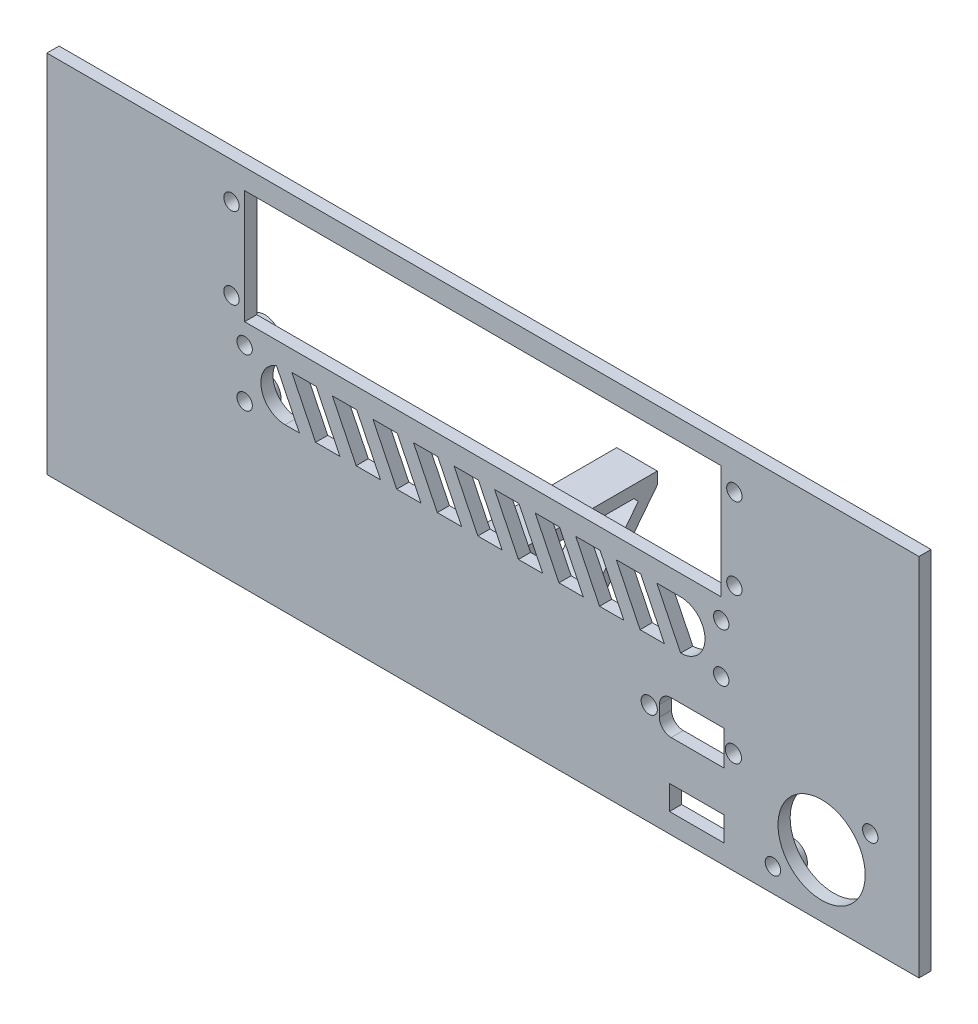
from build123d import *
from OCP.BRepFilletAPI import BRepFilletAPI_MakeChamfer

# Parameters (mm, degrees)
SZKIC1_W                    = 215
SZKIC1_H                    = 90
DODANIE_WYCI_GNI_CIE1_DEPTH = 3
DODANIE_WYCI_GNI_CIE3_DEPTH = 5
SZKIC4_R                    = 1.9
WYTNIJ_WYCI_GNI_CIE1_DEPTH  = 10
SZKIC5_R                    = 1.9
SZKIC5_W                    = 117.5
SZKIC5_H                    = 28
WYTNIJ_WYCI_GNI_CIE2_DEPTH  = 35
SFAZOWANIE1_SIZE            = 2
SFAZOWANIE1_SIZE2           = 1.42483793
SFAZOWANIE1_SIZE2_2         = 2.349845037
SZKIC6_R                    = 10.75
SZKIC6_R_2                  = 1.9
SZKIC6_R_3                  = 2
SZKIC6_W                    = 13.5
SZKIC6_H                    = 6
WYTNIJ_WYCI_GNI_CIE3_DEPTH  = 237.154610372
SZKIC8_R                    = 3.5
SZKIC8_R_2                  = 2
DODANIE_WYCI_GNI_CIE4_DEPTH = 2
SZKIC9_R                    = 1.9
WYTNIJ_WYCI_GNI_CIE4_DEPTH  = 3
DODANIE_WYCI_GNI_CIE5_START = 2
SZKIC10_R                   = 4
SZKIC10_R_2                 = 1.9
DODANIE_WYCI_GNI_CIE5_DEPTH = 2


with BuildPart() as part:
    # Szkic1 → Dodanie-wyciągnięcie1 (new body)
    with BuildSketch(Plane.XY):
        with Locations((107.5, 45)):
            Rectangle(SZKIC1_W, SZKIC1_H)
    extrude(amount=DODANIE_WYCI_GNI_CIE1_DEPTH)

    # Szkic3 → Dodanie-wyciągnięcie3 (add, symmetric)
    with BuildSketch(Plane(origin=(107.5, 0, 0), x_dir=(0, 0, -1), z_dir=(1, 0, 0))):
        Polygon((0, 3), (10, 3), (35, 35), (35, 38), (0, 38), align=None)
        Polygon((3, 11.541451884), (3, 35), (31.193011155, 35), (9.799205499, 7.615928759), align=None, mode=Mode.SUBTRACT)
    extrude(amount=DODANIE_WYCI_GNI_CIE3_DEPTH, both=True)

    # Szkic4 → Wytnij-wyciągnięcie1 (cut)
    with BuildSketch(Plane.XZ.offset(-3)):
        with Locations(Location((107.5, -5, 0), (0, 0, 270))):
            Circle(SZKIC4_R)
    extrude(amount=-WYTNIJ_WYCI_GNI_CIE1_DEPTH, mode=Mode.SUBTRACT)

    # Szkic5 → Wytnij-wyciągnięcie2 (cut)
    with BuildSketch(Plane.XY.offset(3)):
        with Locations((45.5, 81)):
            Circle(SZKIC5_R)
        with Locations((45.5, 61)):
            Circle(SZKIC5_R)
        with Locations((169.5, 61)):
            Circle(SZKIC5_R)
        with Locations((169.5, 81)):
            Circle(SZKIC5_R)
        with Locations((107.5, 71)):
            Rectangle(SZKIC5_W, SZKIC5_H)
    extrude(amount=-WYTNIJ_WYCI_GNI_CIE2_DEPTH, mode=Mode.SUBTRACT)

    # Sfazowanie1: one chamfer whose edges measure the first distance from different faces: ONE call of the kernel's chamfer builder (chamfer() names one face for all edges)
    sfazowanie1_edges_1 = [part.edges().sort_by_distance(p)[0] for p in [
        (107.5, 35, -31.193011155),
    ]]
    sfazowanie1_side_1 = [part.faces().sort_by_distance(p)[0] for p in [
        (107.5, 35, -17.096505578),
    ]]
    sfazowanie1_edges_2 = [part.edges().sort_by_distance(p)[0] for p in [
        (107.5, 35, -3),
    ]]
    sfazowanie1_edges_3 = [part.edges().sort_by_distance(p)[0] for p in [
        (107.5, 7.615928759, -9.799205499),
    ]]
    sfazowanie1_side_3 = [part.faces().sort_by_distance(p)[0] for p in [
        (107.5, 21.30796438, -20.496108327),
    ]]
    sfazowanie1 = BRepFilletAPI_MakeChamfer(part.part.solid().wrapped)
    for e in sfazowanie1_edges_1:
        sfazowanie1.Add(SFAZOWANIE1_SIZE, SFAZOWANIE1_SIZE2, e.wrapped, sfazowanie1_side_1[0].wrapped)  # the first distance lies on this face
    for e in sfazowanie1_edges_2:
        sfazowanie1.Add(SFAZOWANIE1_SIZE, e.wrapped)
    for e in sfazowanie1_edges_3:
        sfazowanie1.Add(SFAZOWANIE1_SIZE, SFAZOWANIE1_SIZE2_2, e.wrapped, sfazowanie1_side_3[0].wrapped)  # the first distance lies on this face
    add(Compound.cast(sfazowanie1.Shape()), mode=Mode.REPLACE)

    # Szkic6 → Wytnij-wyciągnięcie3 (cut, through all)
    with BuildSketch(Plane.XY.offset(3)):
        with Locations((191, 15.35)):
            Circle(SZKIC6_R)
        with Locations((203, 24.85)):
            Circle(SZKIC6_R_2)
        with Locations((179, 5.85)):
            Circle(SZKIC6_R_2)
        with Locations((148.5, 25.05)):
            Circle(SZKIC6_R_3)
        with Locations((169.25, 25.05)):
            Circle(SZKIC6_R_3)
        with Locations((160.25, 7.8)):
            Rectangle(SZKIC6_W, SZKIC6_H)
        with BuildLine():
            Line((167, 20.8), (153.9, 20.8))
            ThreePointArc((153.9, 20.8), (151.849390335, 21.649390335), (151, 23.7))
            Line((151, 23.7), (151, 26.4))
            ThreePointArc((151, 26.4), (151.849390335, 28.450609665), (153.9, 29.3))
            Line((153.9, 29.3), (167, 29.3))
            Line((167, 29.3), (167, 20.8))
        make_face()
    extrude(amount=-WYTNIJ_WYCI_GNI_CIE3_DEPTH, mode=Mode.SUBTRACT)

    # Szkic8 → Dodanie-wyciągnięcie4 (add)
    # profile 1 of 2: a face of its own
    with BuildSketch(Plane(origin=(0, 0, 0), x_dir=(-1, 0, 0), z_dir=(0, 0, -1))):
        with Locations((-179, 5.85)):
            Circle(SZKIC8_R)
        with Locations((-179, 5.85)):
            Circle(SZKIC8_R_2, mode=Mode.SUBTRACT)
    # profile 2 of 2: a face of its own
    with BuildSketch(Plane(origin=(0, 0, 0), x_dir=(-1, 0, 0), z_dir=(0, 0, -1))):
        with Locations((-203, 24.85)):
            Circle(SZKIC8_R)
        with Locations((-203, 24.85)):
            Circle(SZKIC8_R_2, mode=Mode.SUBTRACT)
    extrude(amount=DODANIE_WYCI_GNI_CIE4_DEPTH)

    # Szkic9 → Wytnij-wyciągnięcie4 (cut)
    with BuildSketch(Plane(origin=(0, 0, 0), x_dir=(-1, 0, 0), z_dir=(0, 0, -1))):
        with Locations((-166.25, 52)):
            Circle(SZKIC9_R)
        with Locations((-166.25, 40)):
            Circle(SZKIC9_R)
        with BuildLine():
            Line((-150.385024789, 52), (-156.25, 52))
            ThreePointArc((-156.25, 52), (-162.25, 46), (-156.25, 40))
            Line((-156.25, 40), (-150.385024789, 52))
        make_face()
        Polygon((-140.385024789, 52), (-146.385024789, 52), (-152.25, 40), (-146.25, 40), align=None)
        Polygon((-130.385024789, 52), (-136.385024789, 52), (-142.25, 40), (-136.25, 40), align=None)
        Polygon((-120.385024789, 52), (-126.385024789, 52), (-132.25, 40), (-126.25, 40), align=None)
        Polygon((-110.385024789, 52), (-116.385024789, 52), (-122.25, 40), (-116.25, 40), align=None)
        Polygon((-100.385024789, 52), (-106.385024789, 52), (-112.25, 40), (-106.25, 40), align=None)
        Polygon((-90.385024789, 52), (-96.385024789, 52), (-102.25, 40), (-96.25, 40), align=None)
        Polygon((-80.385024789, 52), (-86.385024789, 52), (-92.25, 40), (-86.25, 40), align=None)
        Polygon((-70.385024789, 52), (-76.385024789, 52), (-82.25, 40), (-76.25, 40), align=None)
        Polygon((-60.385024789, 52), (-66.385024789, 52), (-72.25, 40), (-66.25, 40), align=None)
        with BuildLine():
            Line((-56.582969685, 51.594995944), (-62.25, 40))
            Line((-62.25, 40), (-58.75, 40))
            ThreePointArc((-58.75, 40), (-52.852120056, 44.897724096), (-56.582969685, 51.594995944))
        make_face()
        with Locations((-48.75, 40)):
            Circle(SZKIC9_R)
        with Locations((-48.75, 52)):
            Circle(SZKIC9_R)
    extrude(amount=-WYTNIJ_WYCI_GNI_CIE4_DEPTH, mode=Mode.SUBTRACT)

    # Szkic10 → Dodanie-wyciągnięcie5 (add)
    # profile 1 of 4: a face of its own
    with BuildSketch(Plane(origin=(0, 0, 0), x_dir=(-1, 0, 0), z_dir=(0, 0, -1)).offset(DODANIE_WYCI_GNI_CIE5_START)):
        with Locations((-166.25, 52)):
            Circle(SZKIC10_R)
        with Locations((-166.25, 52)):
            Circle(SZKIC10_R_2, mode=Mode.SUBTRACT)
    # profile 2 of 4: a face of its own
    with BuildSketch(Plane(origin=(0, 0, 0), x_dir=(-1, 0, 0), z_dir=(0, 0, -1)).offset(DODANIE_WYCI_GNI_CIE5_START)):
        with Locations((-166.25, 40)):
            Circle(SZKIC10_R)
        with Locations((-166.25, 40)):
            Circle(SZKIC10_R_2, mode=Mode.SUBTRACT)
    # profile 3 of 4: a face of its own
    with BuildSketch(Plane(origin=(0, 0, 0), x_dir=(-1, 0, 0), z_dir=(0, 0, -1)).offset(DODANIE_WYCI_GNI_CIE5_START)):
        with Locations((-48.75, 40)):
            Circle(SZKIC10_R)
        with Locations((-48.75, 40)):
            Circle(SZKIC10_R_2, mode=Mode.SUBTRACT)
    # profile 4 of 4: a face of its own
    with BuildSketch(Plane(origin=(0, 0, 0), x_dir=(-1, 0, 0), z_dir=(0, 0, -1)).offset(DODANIE_WYCI_GNI_CIE5_START)):
        with Locations((-48.75, 52)):
            Circle(SZKIC10_R)
        with Locations((-48.75, 52)):
            Circle(SZKIC10_R_2, mode=Mode.SUBTRACT)
    extrude(amount=-DODANIE_WYCI_GNI_CIE5_DEPTH)


solid = part.part
